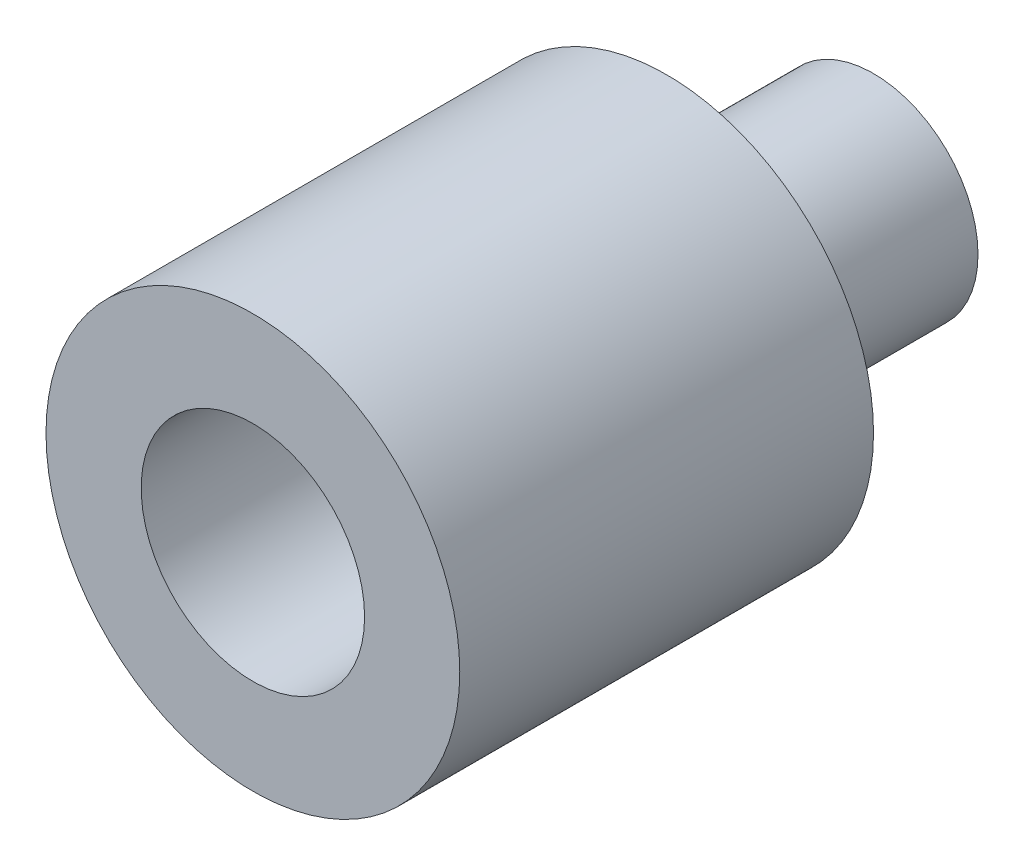
from build123d import *

# Parameters (mm, degrees)
SKETCH1_R           = 2.525
BOSS_EXTRUDE1_DEPTH = 5
SKETCH2_R           = 5
BOSS_EXTRUDE2_DEPTH = 10
SKETCH3_R           = 2.7
CUT_EXTRUDE1_DEPTH  = 8


with BuildPart() as part:
    # Sketch1 → Boss-Extrude1 (new body)
    with BuildSketch(Plane.XY):
        Circle(SKETCH1_R)
    extrude(amount=BOSS_EXTRUDE1_DEPTH)

    # Sketch2 → Boss-Extrude2 (add)
    with BuildSketch(Plane.XY.offset(5)):
        Circle(SKETCH2_R)
    extrude(amount=BOSS_EXTRUDE2_DEPTH)

    # Sketch3 → Cut-Extrude1 (cut)
    with BuildSketch(Plane.XY.offset(15)):
        Circle(SKETCH3_R)
    extrude(amount=-CUT_EXTRUDE1_DEPTH, mode=Mode.SUBTRACT)


solid = part.part
